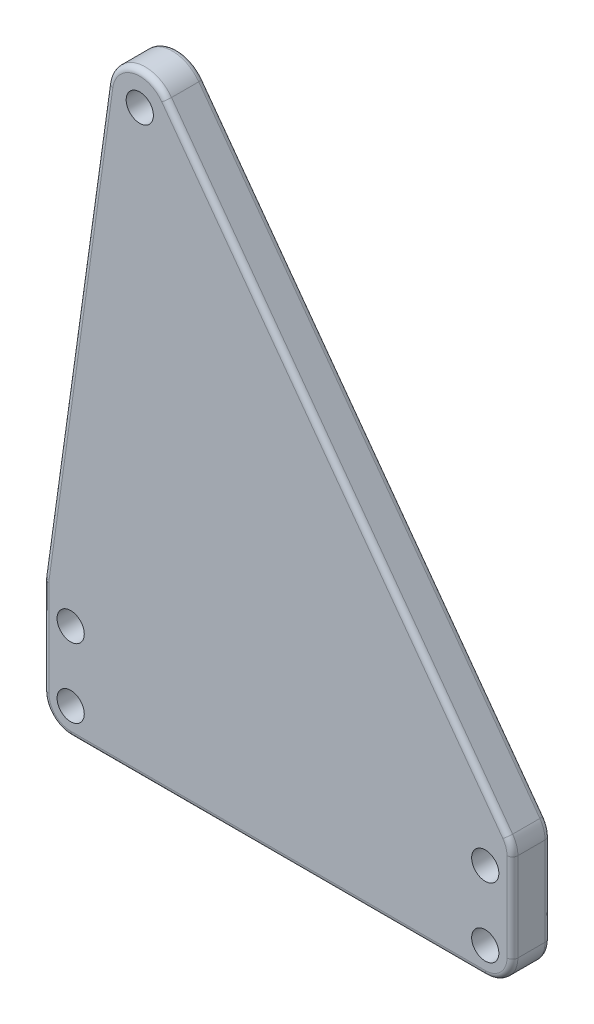
from build123d import *

# Parameters (mm, degrees)
SKETCH1_R           = 2.5
SKETCH1_R_2         = 6
BOSS_EXTRUDE1_DEPTH = 7
FILLET1_R           = 5
FILLET2_R           = 1


with BuildPart() as part:
    # Sketch1 → Boss-Extrude1 (new body)
    # profile 1 of 2: a face of its own
    with BuildSketch(Plane.XY):
        with BuildLine():
            Line((-5.942775796, 0.826689684), (-17.7, -83.691780519))
            Line((-17.7, -83.691780519), (-17.7, -106.6))
            Line((-17.7, -106.6), (68.5, -106.6))
            Line((68.5, -106.6), (68.5, -83.691780519))
            Line((68.5, -83.691780519), (4.84674687, 3.5368128))
            ThreePointArc((4.84674687, 3.5368128), (5.704405369, 1.860042846), (6, 0))
            ThreePointArc((6, 0), (-0.414333936, -5.985676853), (-5.942775796, 0.826689684))
        make_face()
        with Locations((-12.7, -101.6)):
            Circle(SKETCH1_R, mode=Mode.SUBTRACT)
        with Locations((-12.7, -88.9)):
            Circle(SKETCH1_R, mode=Mode.SUBTRACT)
        with Locations((63.5, -101.6)):
            Circle(SKETCH1_R, mode=Mode.SUBTRACT)
        with Locations((63.5, -88.9)):
            Circle(SKETCH1_R, mode=Mode.SUBTRACT)
    # profile 2 of 2: a face of its own
    with BuildSketch(Plane.XY):
        Circle(SKETCH1_R_2)
        Circle(SKETCH1_R, mode=Mode.SUBTRACT)
    extrude(amount=BOSS_EXTRUDE1_DEPTH)

    # Fillet1
    fillet1_edges = [part.edges().sort_by_distance(p)[0] for p in [
        (68.5, -83.691780519, 3.5),
        (68.5, -106.6, 3.5),
        (-17.7, -106.6, 3.5),
        (-17.7, -83.691780519, 3.5),
    ]]
    fillet(fillet1_edges, radius=FILLET1_R)

    # Fillet2
    fillet2_edges = [part.edges().sort_by_distance(p)[0] for p in [
        (-1.461681114, 5.819234342, 7),
        (-1.461681114, 5.819234342, 0),
        (-17.7, -92.818942509, 0),
        (-17.7, -92.818942509, 7),
        (36.192851297, -39.418990098, 0),
        (68.5, -93.461068497, 0),
        (25.4, -106.6, 0),
        (-11.79754448, -41.261143632, 0),
        (-16.235533906, -105.135533906, 0),
        (67.035533906, -105.135533906, 0),
        (68.25367114, -83.77210129, 0),
        (-17.688064044, -83.692606737, 0),
        (-11.79754448, -41.261143632, 7),
        (36.192851297, -39.418990098, 7),
        (25.4, -106.6, 7),
        (68.5, -93.461068497, 7),
        (-16.235533906, -105.135533906, 7),
        (67.035533906, -105.135533906, 7),
        (68.25367114, -83.77210129, 7),
        (-17.688064044, -83.692606737, 7),
    ]]
    fillet(fillet2_edges, radius=FILLET2_R)


solid = part.part
